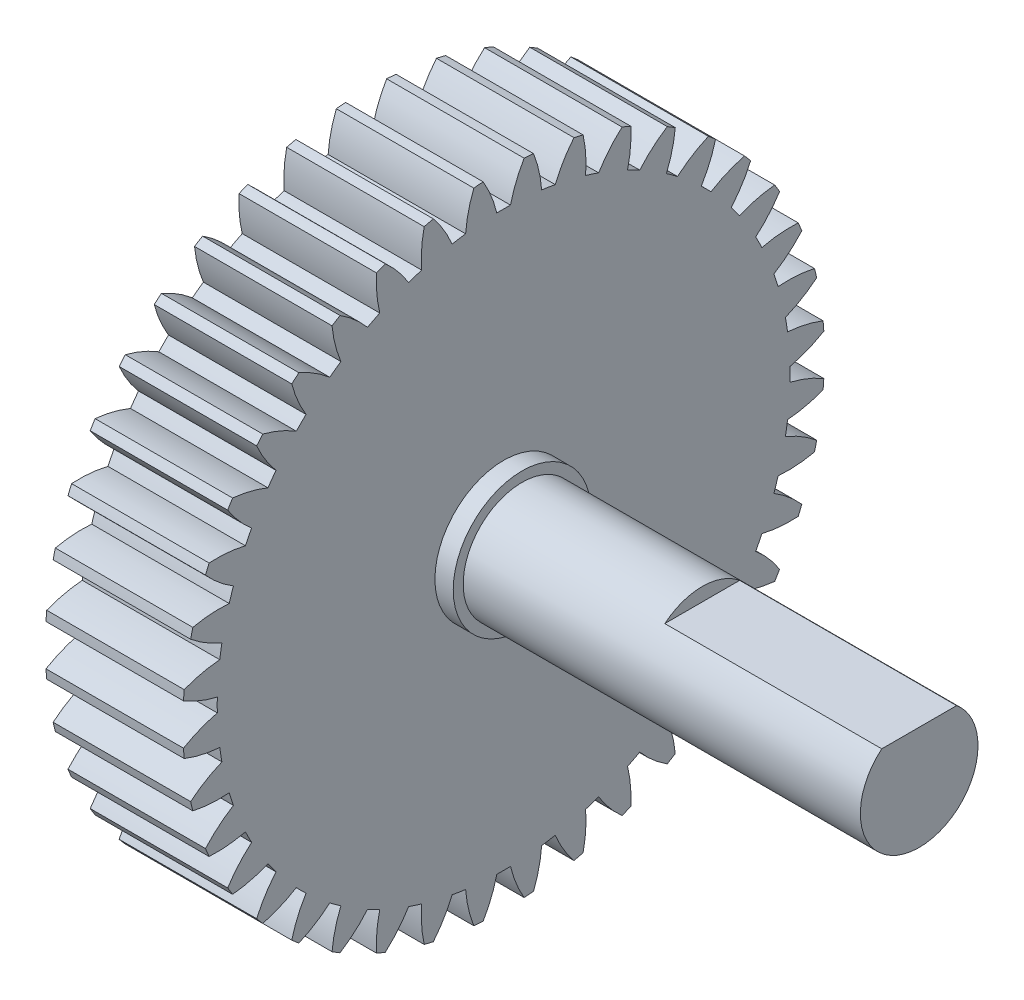
from build123d import *

# Parameters (mm, degrees)
BASPROSKE_W              = 9
BASPROSKE_H              = 21
TOOTHCUT_DEPTH           = 32.032241298
TEETHCUTS_COUNT          = 40
TEETHCUTS_ANGLE          = 351
BORSKE_R                 = 2
BORE_DEPTH               = 50.0000508
BOSS_EXTRUDE1_DEPTH      = 27.2
BOSS_EXTRUDE1_DEPTH_BACK = 9
BOSS_EXTRUDE2_DEPTH      = 13
BOSS_EXTRUDE2_DEPTH_BACK = 9
SKETCH1_4_R              = 4.5
BOSS_EXTRUDE3_DEPTH      = 1.2


with BuildPart() as part:
    # BasProSke → Base-Revolve (revolve)
    with BuildSketch(Plane(origin=(0, 0, 0), x_dir=(1, 0, 0), z_dir=(0, 1, 0))):
        with Locations((4.5, 10.5)):
            Rectangle(BASPROSKE_W, BASPROSKE_H)
    revolve(axis=Axis((-10, 0, 0), (1, 0, 0)))

    # TooCutSke → ToothCut (cut, through all)
    with BuildSketch(Plane(origin=(0, 0, 0), x_dir=(0, 0, -1), z_dir=(1, 0, 0))):
        with BuildLine():
            ThreePointArc((0.448673268, 18.74363074), (0, 18.749), (-0.448673268, 18.74363074))
            ThreePointArc((-0.448673268, 18.74363074), (-0.816786816, 19.89705013), (-1.354745081, 20.981708961))
            ThreePointArc((-1.354745081, 20.981708961), (0, 21.0254), (1.354745081, 20.981708961))
            ThreePointArc((1.354745081, 20.981708961), (0.816786816, 19.89705013), (0.448673268, 18.74363074))
        make_face()
    toothcut = extrude(amount=TOOTHCUT_DEPTH, mode=Mode.SUBTRACT)

    # TeethCuts: ToothCut ×40 about axis
    teethcuts_axis = Axis((-10, 0, 0), (1, 0, 0))
    for i in range(1, TEETHCUTS_COUNT):
        add(toothcut.rotate(teethcuts_axis, i * TEETHCUTS_ANGLE / (TEETHCUTS_COUNT - 1)), mode=Mode.SUBTRACT)

    # BorSke → Bore (cut, symmetric)
    with BuildSketch(Plane(origin=(0, 0, 0), x_dir=(0, 0, -1), z_dir=(1, 0, 0))):
        Circle(BORSKE_R)
    extrude(amount=BORE_DEPTH, both=True, mode=Mode.SUBTRACT)

    # Sketch1 → Boss-Extrude1 (add, two sides: drawn at the far end of the back side and taken through both)
    with BuildSketch(Plane(origin=(9, 0, 0), x_dir=(0, 0, -1), z_dir=(1, 0, 0)).offset(-BOSS_EXTRUDE1_DEPTH_BACK)):
        with BuildLine():
            Line((2.45, 2.969848481), (-2.45, 2.969848481))
            ThreePointArc((-2.45, 2.969848481), (-1.641645516, -3.48245603), (3.85, 0))
            ThreePointArc((3.85, 0), (3.48245603, 1.641645516), (2.45, 2.969848481))
        make_face()
    extrude(amount=BOSS_EXTRUDE1_DEPTH + BOSS_EXTRUDE1_DEPTH_BACK)

    # Sketch1<3> → Boss-Extrude2 (add, two sides: drawn at the far end of the back side and taken through both)
    with BuildSketch(Plane(origin=(9, 0, 0), x_dir=(0, 0, -1), z_dir=(1, 0, 0)).offset(-BOSS_EXTRUDE2_DEPTH_BACK)):
        with BuildLine():
            ThreePointArc((2.45, 2.969848481), (0, 3.85), (-2.45, 2.969848481))
            Line((-2.45, 2.969848481), (2.45, 2.969848481))
        make_face()
    extrude(amount=BOSS_EXTRUDE2_DEPTH + BOSS_EXTRUDE2_DEPTH_BACK)

    # Sketch1<4> → Boss-Extrude3 (add)
    with BuildSketch(Plane(origin=(9, 0, 0), x_dir=(0, 0, -1), z_dir=(1, 0, 0))):
        Circle(SKETCH1_4_R)
        with BuildLine():
            ThreePointArc((3.85, 0), (-1.641645516, -3.48245603), (-2.45, 2.969848481))
            ThreePointArc((-2.45, 2.969848481), (0, 3.85), (2.45, 2.969848481))
            ThreePointArc((2.45, 2.969848481), (3.48245603, 1.641645516), (3.85, 0))
        make_face(mode=Mode.SUBTRACT)
    extrude(amount=BOSS_EXTRUDE3_DEPTH)


solid = part.part
